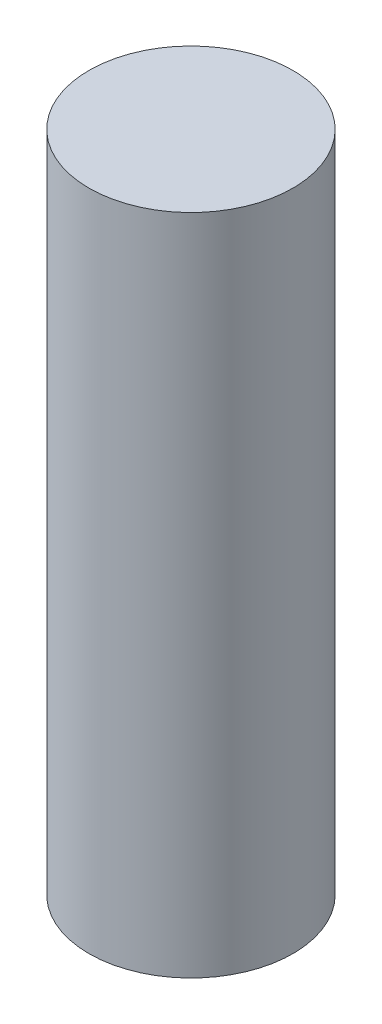
from build123d import *

# Parameters (mm, degrees)
SKETCH1_R           = 50
BOSS_EXTRUDE1_DEPTH = 325
SCALE1_SCALE        = 0.75


with BuildPart() as part:
    # Sketch1 → Boss-Extrude1 (new body)
    with BuildSketch(Plane(origin=(0, 0, 0), x_dir=(1, 0, 0), z_dir=(0, 1, 0))):
        with Locations(Location((0, 0, 0), (0, 0, 270))):
            Circle(SKETCH1_R)
    extrude(amount=BOSS_EXTRUDE1_DEPTH)


with BuildPart() as part_1:
    # Scale1: scaled about (0, 162.5, 0)
    add(part.part.scale(SCALE1_SCALE).moved(Location((0, 40.625, 0))))


solid = part_1.part
